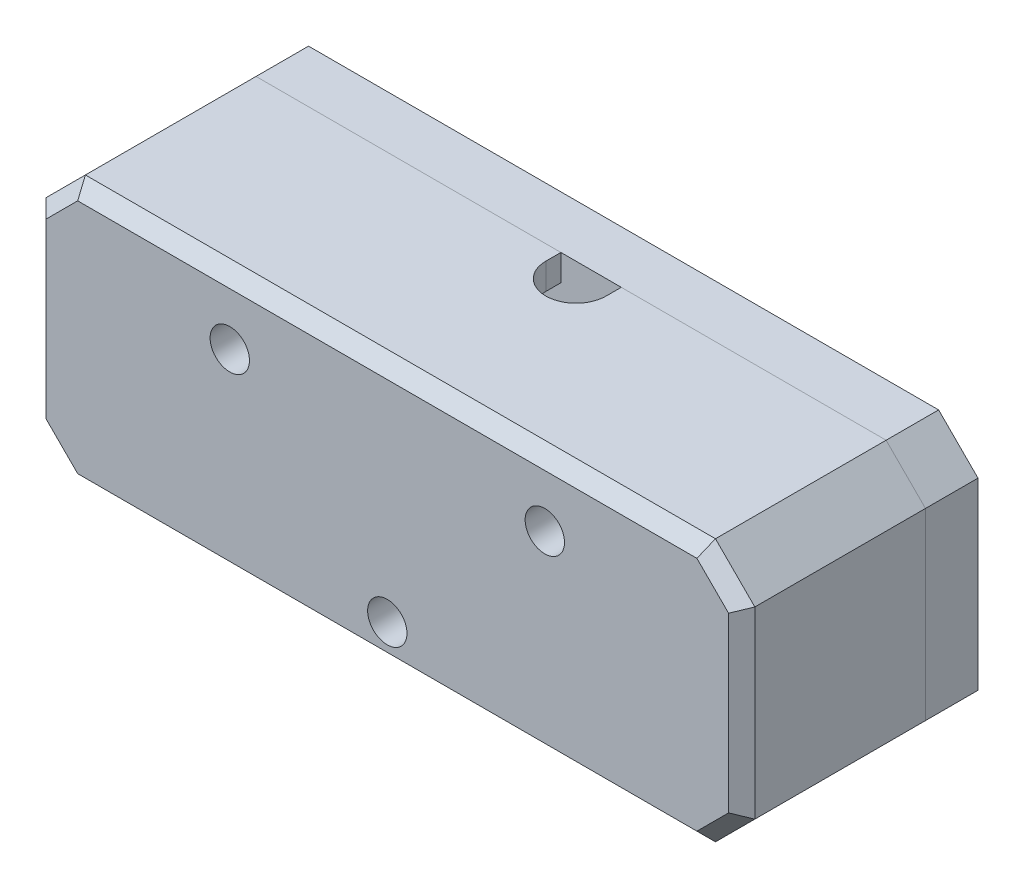
from build123d import *

# Parameters (mm, degrees)
SKETCH3_W           = 54
SKETCH3_H           = 20
SKETCH3_R           = 2.6
BOSS_EXTRUDE1_DEPTH = 4
SKETCH4_W           = 30
SKETCH4_H           = 6
BOSS_EXTRUDE2_DEPTH = 11
SKETCH5_R           = 1.5
CUT_EXTRUDE1_DEPTH  = 6
CUT_EXTRUDE2_DEPTH  = 2
CHAMFER1_SIZE       = 3
BOSS_EXTRUDE3_DEPTH = 11
BOSS_EXTRUDE4_DEPTH = 3
SKETCH11_R          = 1.5
CUT_EXTRUDE3_DEPTH  = 3
BOSS_EXTRUDE5_DEPTH = 11
SKETCH13_R          = 1.375
CUT_EXTRUDE4_DEPTH  = 8
CHAMFER2_SIZE       = 1
CUT_EXTRUDE5_DEPTH  = 2


with BuildPart() as part:
    # Sketch3 → Boss-Extrude1 (new body)
    with BuildSketch(Plane.XY):
        with Locations((-1.525, 0)):
            Rectangle(SKETCH3_W, SKETCH3_H)
        with Locations((-21.525, 0)):
            Circle(SKETCH3_R, mode=Mode.SUBTRACT)
        with Locations((18.475, 0)):
            Circle(SKETCH3_R, mode=Mode.SUBTRACT)
    extrude(amount=BOSS_EXTRUDE1_DEPTH)

    # Sketch4 → Boss-Extrude2 (add)
    with BuildSketch(Plane.XY.offset(4)):
        with Locations((-1.525, -7)):
            Rectangle(SKETCH4_W, SKETCH4_H)
    extrude(amount=BOSS_EXTRUDE2_DEPTH)

    # Sketch5 → Cut-Extrude1 (cut)
    with BuildSketch(Plane.XZ.offset(10)):
        with Locations((-9.025, 8.5)):
            Circle(SKETCH5_R)
        with Locations((5.975, 8.5)):
            Circle(SKETCH5_R)
    extrude(amount=-CUT_EXTRUDE1_DEPTH, mode=Mode.SUBTRACT)

    # Sketch6 → Cut-Extrude2 (cut)
    with BuildSketch(Plane(origin=(0, -4, 0), x_dir=(1, 0, 0), z_dir=(0, 1, 0))):
        Polygon((-9.025, -5.353441033), (-11.75, -6.926720516), (-11.75, -10.073279484), (-9.025, -11.646558967), (-6.3, -10.073279484), (-6.3, -6.926720516), align=None)
        Polygon((5.975, -5.353441033), (3.25, -6.926720516), (3.25, -10.073279484), (5.975, -11.646558967), (8.7, -10.073279484), (8.7, -6.926720516), align=None)
    extrude(amount=-CUT_EXTRUDE2_DEPTH, mode=Mode.SUBTRACT)

    # Chamfer1
    chamfer1_edges = [part.edges().sort_by_distance(p)[0] for p in [
        (-28.525, 10, 2),
        (25.475, 10, 2),
        (25.475, -10, 2),
        (-28.525, -10, 2),
    ]]
    chamfer(chamfer1_edges, length=CHAMFER1_SIZE)

    # Sketch12 → Boss-Extrude5 (add)
    with BuildSketch(Plane(origin=(0, 0, 15), x_dir=(-1, 0, 0), z_dir=(0, 0, -1))):
        with BuildLine():
            Line((10.025, 5), (10.025, 8))
            Line((10.025, 8), (17.025, 8))
            Line((17.025, 8), (17.025, 5))
            ThreePointArc((17.025, 5), (13.525, 1.5), (10.025, 5))
        make_face()
        with BuildLine():
            Line((-13.975, 5), (-13.975, 8))
            Line((-13.975, 8), (-6.975, 8))
            Line((-6.975, 8), (-6.975, 5))
            ThreePointArc((-6.975, 5), (-10.475, 1.5), (-13.975, 5))
        make_face()
    extrude(amount=BOSS_EXTRUDE5_DEPTH)

    # Sketch13 → Cut-Extrude4 (cut)
    with BuildSketch(Plane.XY.offset(15)):
        with Locations((-13.525, 5)):
            Circle(SKETCH13_R)
        with Locations((10.475, 5)):
            Circle(SKETCH13_R)
        with Locations((-1.525, -7)):
            Circle(SKETCH13_R)
    extrude(amount=-CUT_EXTRUDE4_DEPTH, mode=Mode.SUBTRACT)


with BuildPart() as body_2:
    # Sketch9 → Boss-Extrude3 (new body)
    with BuildSketch(Plane.XY.offset(4)):
        Polygon((22.475, -10), (13.675, -10), (13.675, -8), (21.646572875, -8), (23.475, -6.171572875), (23.475, 6.171572875), (21.646572875, 8), (-24.696572875, 8), (-26.525, 6.171572875), (-26.525, -6.171572875), (-24.696572875, -8), (-16.725, -8), (-16.725, -10), (-25.525, -10), (-28.525, -7), (-28.525, 7), (-25.525, 10), (22.475, 10), (25.475, 7), (25.475, -7), align=None)
    extrude(amount=BOSS_EXTRUDE3_DEPTH)

    # Sketch10 → Boss-Extrude4 (add)
    with BuildSketch(Plane.XY.offset(15)):
        Polygon((-25.525, -10), (22.475, -10), (25.475, -7), (25.475, 7), (22.475, 10), (-25.525, 10), (-28.525, 7), (-28.525, -7), align=None)
    extrude(amount=BOSS_EXTRUDE4_DEPTH)

    # Sketch11 → Cut-Extrude3 (cut)
    with BuildSketch(Plane.XY.offset(18)):
        with Locations((-1.525, -7)):
            Circle(SKETCH11_R)
        with Locations((-13.525, 5)):
            Circle(SKETCH11_R)
        with Locations((10.475, 5)):
            Circle(SKETCH11_R)
    extrude(amount=-CUT_EXTRUDE3_DEPTH, mode=Mode.SUBTRACT)

    # Chamfer2
    chamfer2_edges = [body_2.edges().sort_by_distance(p)[0] for p in [
        (-27.025, -8.5, 18),
        (-1.525, -10, 18),
        (23.975, -8.5, 18),
        (25.475, 0, 18),
        (23.975, 8.5, 18),
        (-1.525, 10, 18),
        (-27.025, 8.5, 18),
        (-28.525, 0, 18),
    ]]
    chamfer(chamfer2_edges, length=CHAMFER2_SIZE)

    # Sketch14 → Cut-Extrude5 (cut)
    with BuildSketch(Plane(origin=(0, 10, 0), x_dir=(1, 0, 0), z_dir=(0, 1, 0))):
        with BuildLine():
            Line((-2.3, -5.15), (-2.3, -4))
            Line((-2.3, -4), (2.3, -4))
            Line((2.3, -4), (2.3, -5.15))
            ThreePointArc((2.3, -5.15), (0, -7.45), (-2.3, -5.15))
        make_face()
    extrude(amount=-CUT_EXTRUDE5_DEPTH, mode=Mode.SUBTRACT)


solid = Compound([part.part, body_2.part])
